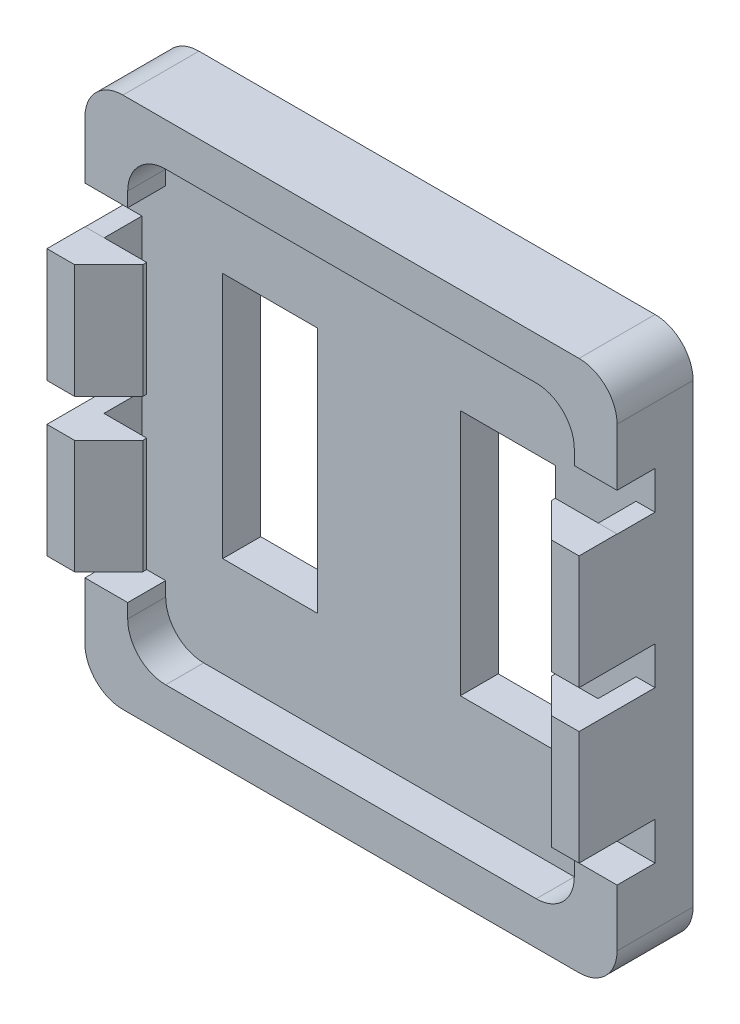
from build123d import *

# Parameters (mm, degrees)
BOSS_EXTRU_1_DEPTH           = 4
ENL_V_MAT_EXTRU_1_DEPTH      = 2
ESQUISSE3_W                  = 5
ESQUISSE3_H                  = 13
ENL_V_MAT_EXTRU_2_DEPTH      = 20.899748742
ESQUISSE4_W                  = 3.25
ESQUISSE4_H                  = 5.994249795
ESQUISSE4_H_2                = 6.005750205
BOSS_EXTRU_2_DEPTH           = 2
CHANFREIN3_SIZE              = 1.8
CHANFREIN3_OF_SYM_TRIE1_SIZE = 1.8


with BuildPart() as part:
    # Esquisse1 → Boss.-Extru.1 (new body)
    with BuildSketch(Plane.XY):
        with BuildLine():
            Line((12, -14), (-12, -14))
            ThreePointArc((-12, -14), (-13.414213562, -13.414213562), (-14, -12))
            Line((-14, -12), (-14, 12))
            ThreePointArc((-14, 12), (-13.414213562, 13.414213562), (-12, 14))
            Line((-12, 14), (12, 14))
            ThreePointArc((12, 14), (13.414213562, 13.414213562), (14, 12))
            Line((14, 12), (14, -12))
            ThreePointArc((14, -12), (13.414213562, -13.414213562), (12, -14))
        make_face()
    extrude(amount=BOSS_EXTRU_1_DEPTH)

    # Esquisse2 → Enlèv. mat.-Extru.1 (cut)
    with BuildSketch(Plane.XY.offset(4)):
        with BuildLine():
            Line((-9.75, -11.75), (9.75, -11.75))
            ThreePointArc((9.75, -11.75), (11.164213562, -11.164213562), (11.75, -9.75))
            Line((11.75, -9.75), (11.75, -9))
            Line((11.75, -9), (14, -9))
            Line((14, -9), (14, -7))
            Line((14, -7), (13, -7))
            Line((13, -7), (13, -1.005750205))
            Line((13, -1.005750205), (14, -1.005750205))
            Line((14, -1.005750205), (14, 0.994249795))
            Line((14, 0.994249795), (13, 0.994249795))
            Line((13, 0.994249795), (13, 6.988499589))
            Line((13, 6.988499589), (14, 6.988499589))
            Line((14, 6.988499589), (14, 8.988499589))
            Line((14, 8.988499589), (11.75, 8.988499589))
            Line((11.75, 8.988499589), (11.75, 9.75))
            ThreePointArc((11.75, 9.75), (11.164213562, 11.164213562), (9.75, 11.75))
            Line((9.75, 11.75), (-9.75, 11.75))
            ThreePointArc((-9.75, 11.75), (-11.164213562, 11.164213562), (-11.75, 9.75))
            Line((-11.75, 9.75), (-11.75, 8.988499589))
            Line((-11.75, 8.988499589), (-14, 8.988499589))
            Line((-14, 8.988499589), (-14, 6.988499589))
            Line((-14, 6.988499589), (-13, 6.988499589))
            Line((-13, 6.988499589), (-13, 0.994249795))
            Line((-13, 0.994249795), (-14, 0.994249795))
            Line((-14, 0.994249795), (-14, -1.005750205))
            Line((-14, -1.005750205), (-13, -1.005750205))
            Line((-13, -1.005750205), (-13, -7))
            Line((-13, -7), (-14, -7))
            Line((-14, -7), (-14, -9))
            Line((-14, -9), (-11.75, -9))
            Line((-11.75, -9), (-11.75, -9.75))
            ThreePointArc((-11.75, -9.75), (-11.164213562, -11.164213562), (-9.75, -11.75))
        make_face()
    extrude(amount=-ENL_V_MAT_EXTRU_1_DEPTH, mode=Mode.SUBTRACT)

    # Esquisse3 → Enlèv. mat.-Extru.2 (cut, through all)
    with BuildSketch(Plane.XY.offset(2)):
        with Locations((-6.25, 0)):
            Rectangle(ESQUISSE3_W, ESQUISSE3_H)
        with Locations((6.25, 0)):
            Rectangle(ESQUISSE3_W, ESQUISSE3_H)
    extrude(amount=-ENL_V_MAT_EXTRU_2_DEPTH, mode=Mode.SUBTRACT)

    # Esquisse4 → Boss.-Extru.2 (add)
    with BuildSketch(Plane.XY.offset(4)):
        with Locations((-12.375, -4.002875103)):
            Rectangle(ESQUISSE4_W, ESQUISSE4_H)
        with Locations((-12.375, 3.997124897)):
            Rectangle(ESQUISSE4_W, ESQUISSE4_H_2)
    boss_extru_2 = extrude(amount=BOSS_EXTRU_2_DEPTH)

    # Chanfrein3
    chanfrein3_edges = [part.edges().sort_by_distance(p)[0] for p in [
        (-10.75, 3.997124897, 6),
        (-10.75, -4.002875103, 6),
    ]]
    chamfer(chanfrein3_edges, length=CHANFREIN3_SIZE)

    # Symétrie1: Boss.-Extru.2 across plane
    add(boss_extru_2.mirror(Plane(origin=(0, 0, 0), x_dir=(0, 0, 1), z_dir=(1, 0, 0))))

    # Chanfrein3 of Symétrie1
    chanfrein3_of_sym_trie1_edges = [part.edges().sort_by_distance(p)[0] for p in [
        (10.75, 3.997124897, 6),
        (10.75, -4.002875103, 6),
    ]]
    chamfer(chanfrein3_of_sym_trie1_edges, length=CHANFREIN3_OF_SYM_TRIE1_SIZE)


solid = part.part
